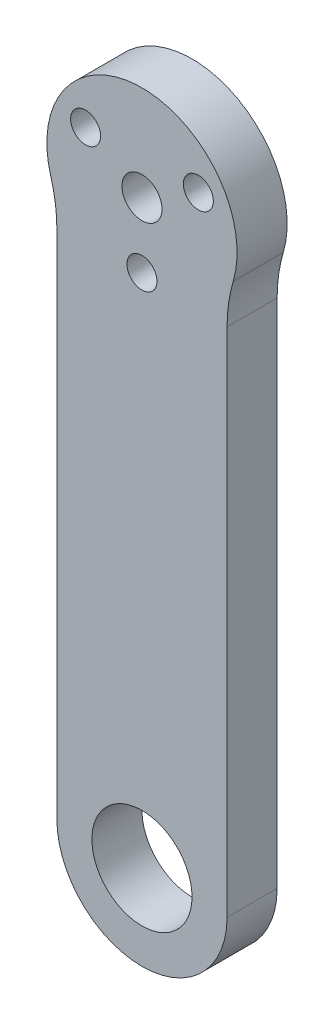
from build123d import *

# Parameters (mm, degrees)
SKETCH_1_R      = 1.5
SKETCH_1_R_2    = 2
SKETCH_1_R_3    = 5
EXTRUDE_1_DEPTH = 5
FILLET_1_R      = 15


with BuildPart() as part:
    # 草图1 → 凸台-拉伸1 (new body)
    with BuildSketch(Plane.XY):
        with BuildLine():
            Line((-8.5, -58), (-8.5, -4.242640687))
            ThreePointArc((-8.5, -4.242640687), (0, 9.5), (8.5, -4.242640687))
            Line((8.5, -4.242640687), (8.5, -58))
            ThreePointArc((8.5, -58), (0, -66.5), (-8.5, -58))
        make_face()
        with Locations((-5.629165125, 3.25)):
            Circle(SKETCH_1_R, mode=Mode.SUBTRACT)
        Circle(SKETCH_1_R_2, mode=Mode.SUBTRACT)
        with Locations((0, -58)):
            Circle(SKETCH_1_R_3, mode=Mode.SUBTRACT)
        with Locations((5.629165125, 3.25)):
            Circle(SKETCH_1_R, mode=Mode.SUBTRACT)
        with Locations((0, -6.5)):
            Circle(SKETCH_1_R, mode=Mode.SUBTRACT)
    extrude(amount=EXTRUDE_1_DEPTH)

    # 圆角1
    fillet_1_edges = [part.edges().sort_by_distance(p)[0] for p in [
        (-8.5, -4.242640687, 2.5),
        (8.5, -4.242640687, 2.5),
    ]]
    fillet(fillet_1_edges, radius=FILLET_1_R)


solid = part.part
